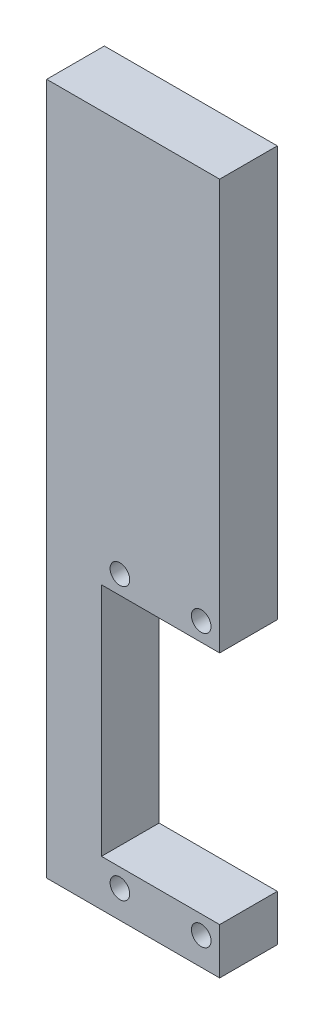
from build123d import *

# Parameters (mm, degrees)
SKETCH2_W           = 30
SKETCH2_H           = 120
BOSS_EXTRUDE1_DEPTH = 10
SKETCH3_R           = 1.7
SKETCH3_W           = 20.5
SKETCH3_H           = 40.8
CUT_EXTRUDE3_DEPTH  = 76.224148804


with BuildPart() as part:
    # Sketch2 → Boss-Extrude1 (new body)
    with BuildSketch(Plane.XY):
        with Locations((-15.991735537, -7.809917355)):
            Rectangle(SKETCH2_W, SKETCH2_H)
    extrude(amount=BOSS_EXTRUDE1_DEPTH)

    # Sketch3 → Cut-Extrude3 (cut, through all)
    with BuildSketch(Plane.XY):
        with Locations((-18.291735537, -62.986209282)):
            Circle(SKETCH3_R)
        with Locations((-4.191735537, -62.986209282)):
            Circle(SKETCH3_R)
        with Locations(Location((-4.191735537, -15.786209282, 0), (0, 0, 180))):
            Circle(SKETCH3_R)
        with Locations(Location((-18.291735537, -15.786209282, 0), (0, 0, 180))):
            Circle(SKETCH3_R)
        with Locations((-11.241735537, -39.386209282)):
            Rectangle(SKETCH3_W, SKETCH3_H)
    extrude(amount=CUT_EXTRUDE3_DEPTH, mode=Mode.SUBTRACT)


solid = part.part
